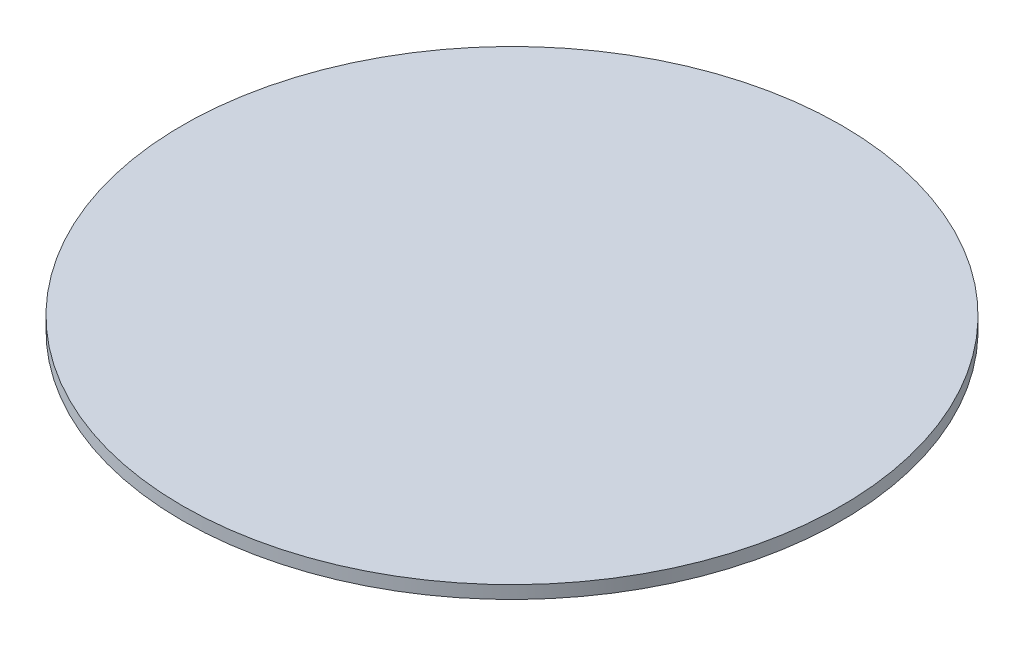
from build123d import *

# Parameters (mm, degrees)
SKETCH1_R           = 25.576085461
BOSS_EXTRUDE1_DEPTH = 1


with BuildPart() as part:
    # Sketch1 → Boss-Extrude1 (new body)
    with BuildSketch(Plane(origin=(0, 0, 0), x_dir=(1, 0, 0), z_dir=(0, 1, 0))):
        Circle(SKETCH1_R)
    extrude(amount=BOSS_EXTRUDE1_DEPTH)


solid = part.part
